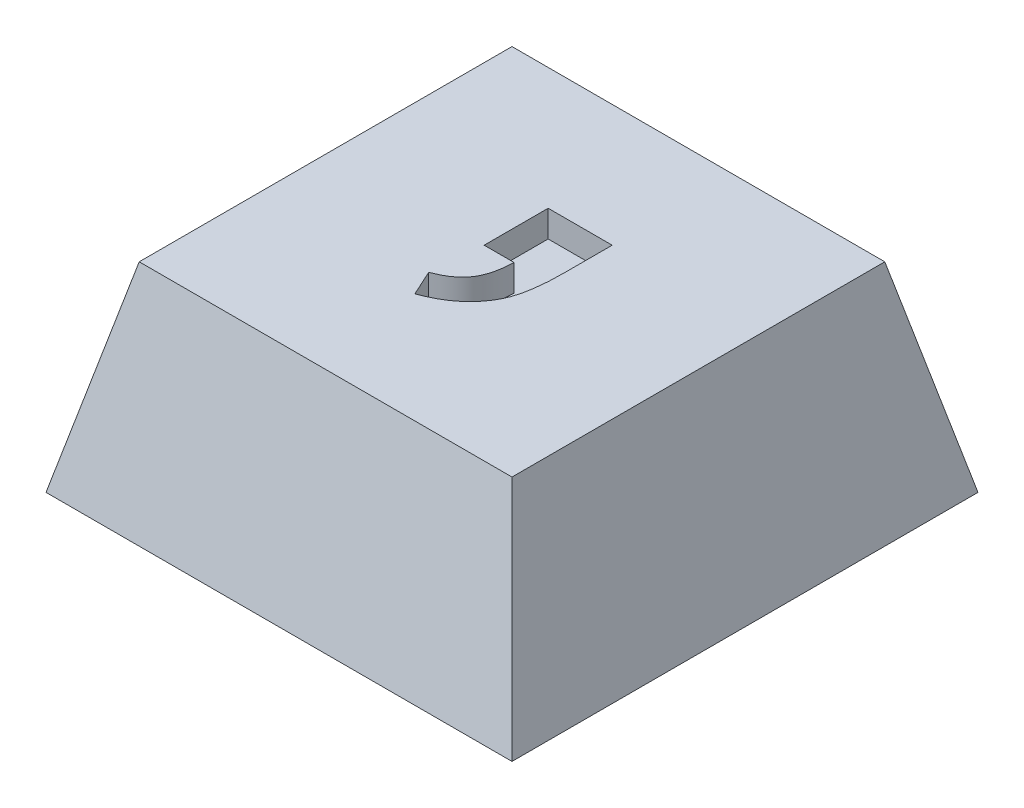
from build123d import *

# Parameters (mm, degrees)
SKETCH1_W           = 7
SKETCH1_H           = 7
BOSS_EXTRUDE1_DEPTH = 3
CUT_EXTRUDE1_DEPTH  = 7
CUT_EXTRUDE2_DEPTH  = 11
SKETCH4_R           = 1.8
CUT_EXTRUDE3_DEPTH  = 0.8
CUT_EXTRUDE4_DEPTH  = 0.4


with BuildPart() as part:
    # Sketch1 → Boss-Extrude1 (new body)
    with BuildSketch(Plane(origin=(0, 0, 0), x_dir=(1, 0, 0), z_dir=(0, 1, 0))):
        with Locations((3.5, 3.5)):
            Rectangle(SKETCH1_W, SKETCH1_H)
    extrude(amount=BOSS_EXTRUDE1_DEPTH)

    # Sketch2 → Cut-Extrude1 (cut)
    with BuildSketch(Plane.XY):
        Polygon((0, 0), (0.7, 3), (0, 3), align=None)
        Polygon((7, 0), (6.3, 3), (7, 3), align=None)
    extrude(amount=-CUT_EXTRUDE1_DEPTH, mode=Mode.SUBTRACT)

    # Sketch3 → Cut-Extrude2 (cut)
    with BuildSketch(Plane(origin=(0, 0, 0), x_dir=(0, 0, -1), z_dir=(1, 0, 0))):
        Polygon((0, 0), (0.7, 3), (0, 3), align=None)
        Polygon((7, 3), (6.3, 3), (7, 0), align=None)
    extrude(amount=CUT_EXTRUDE2_DEPTH, mode=Mode.SUBTRACT)

    # Sketch4 → Cut-Extrude3 (cut)
    with BuildSketch(Plane.XZ):
        with Locations(Location((3.5, -3.5, 0), (0, 0, 270))):
            Circle(SKETCH4_R)
    extrude(amount=-CUT_EXTRUDE3_DEPTH, mode=Mode.SUBTRACT)

    # Sketch5 → Cut-Extrude4 (cut)
    with BuildSketch(Plane(origin=(0, 3, 0), x_dir=(1, 0, 0), z_dir=(0, 1, 0))):
        with BuildLine():
            Line((3.074992012, 4.468285429), (4.036530474, 4.468285429))
            Line((4.036530474, 4.468285429), (4.036530474, 3.769166839))
            add(Edge.make_bspline(
                [(4.036530474, 3.769166839), (4.036086851, 3.702022613), (4.035249234, 3.575245505), (4.020566764, 3.39640898), (4.000165605, 3.239359877), (3.967710391, 3.102079519), (3.924256019, 2.978103986), (3.862818552, 2.864662172), (3.787262222, 2.756102323), (3.694844376, 2.655709349), (3.588530384, 2.562855929), (3.467088334, 2.482109847), (3.333400229, 2.410169074), (3.237355705, 2.372295276), (3.188173102, 2.352900814)],
                knots=[0, 0, 0, 0, 1.347156832, 2.543608823, 3.599300285, 4.522475688, 5.370350604, 6.227678973, 7.103274953, 8.018757603, 8.959280198, 9.929437417, 10.939703653, 12, 12, 12, 12], degree=3))
            Line((3.188173102, 2.352900814), (3.010889448, 2.737516198))
            add(Edge.make_bspline(
                [(3.010889448, 2.737516198), (3.053777828, 2.755154018), (3.135615846, 2.78880985), (3.245316967, 2.853643094), (3.334062536, 2.929935998), (3.405416723, 3.016399576), (3.45643151, 3.118107137), (3.494770079, 3.233341119), (3.516994248, 3.365049182), (3.521395894, 3.457921451), (3.523709961, 3.506746968)],
                knots=[0, 0, 0, 0, 1.113959817, 2.125616841, 3.047494432, 3.914868512, 4.801521967, 5.765947312, 6.825496818, 8, 8, 8, 8], degree=3))
            Line((3.523709961, 3.506746968), (3.074992012, 3.506746968))
            Line((3.074992012, 3.506746968), (3.074992012, 4.468285429))
        make_face()
    extrude(amount=-CUT_EXTRUDE4_DEPTH, mode=Mode.SUBTRACT)


solid = part.part
